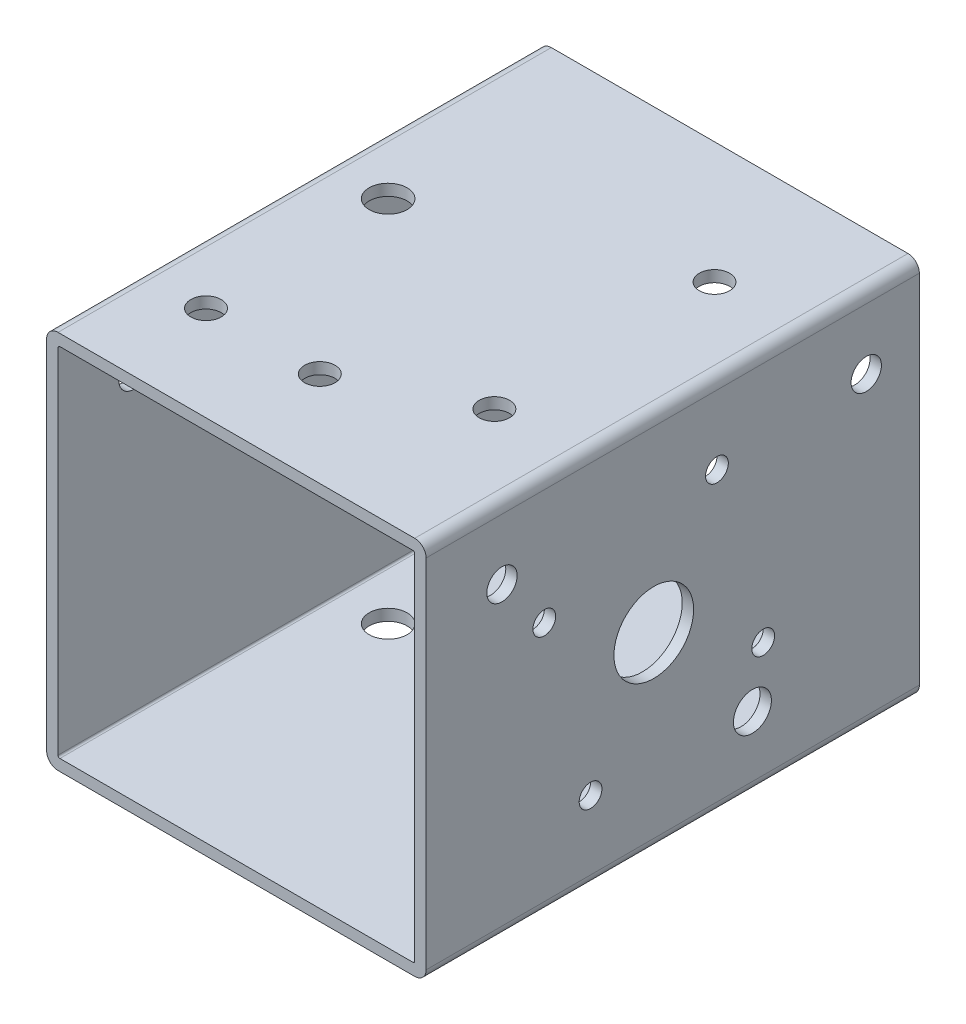
from build123d import *

# Parameters (mm, degrees)
SKETCH1_W                      = 100
SKETCH1_H                      = 100
SKETCH1_W_2                    = 94
SKETCH1_H_2                    = 94
EXTRUDE_THIN1_DEPTH            = 130
FILLET1_R                      = 0.5
FILLET2_R                      = 3
F_8_0_8_DIAMETER_HOLE2_D       = 8
F_8_0_8_DIAMETER_HOLE3_D       = 8
F_10_0_10_DIAMETER_HOLE1_D     = 10
F_10_0_10_DIAMETER_HOLE2_D     = 10
F_6_0_6_DIAMETER_HOLE2_D       = 6
F_6_0_6_DIAMETER_HOLE2_DEPTH   = 3
F_6_0_6_DIAMETER_HOLE3_D       = 6
F_6_0_6_DIAMETER_HOLE3_DEPTH   = 3
F_21_0_21_DIAMETER_HOLE1_D     = 21
F_21_0_21_DIAMETER_HOLE1_DEPTH = 3
F_6_0_6_DIAMETER_HOLE1_D       = 6
F_6_0_6_DIAMETER_HOLE1_DEPTH   = 3
F_8_0_8_DIAMETER_HOLE4_D       = 8
F_8_0_8_DIAMETER_HOLE4_DEPTH   = 3
SKETCH33_R                     = 4
CUT_EXTRUDE1_DEPTH             = 10


with BuildPart() as part:
    # Sketch1 → Extrude-Thin1 (new body)
    with BuildSketch(Plane.XY):
        Rectangle(SKETCH1_W, SKETCH1_H)
        Rectangle(SKETCH1_W_2, SKETCH1_H_2, mode=Mode.SUBTRACT)
    extrude(amount=EXTRUDE_THIN1_DEPTH)

    # Fillet1
    fillet1_edges = [part.edges().sort_by_distance(p)[0] for p in [
        (47, -47, 65),
        (47, 47, 65),
        (-47, 47, 65),
        (-47, -47, 65),
    ]]
    fillet(fillet1_edges, radius=FILLET1_R)

    # Fillet2
    fillet2_edges = [part.edges().sort_by_distance(p)[0] for p in [
        (50, -50, 65),
        (-50, -50, 65),
        (-50, 50, 65),
        (50, 50, 65),
    ]]
    fillet(fillet2_edges, radius=FILLET2_R)

    # Ø8.0 (8) Diameter Hole2 (through all)
    with Locations(Plane(origin=(0, 50, 0), x_dir=(1, 0, 0), z_dir=(0, 1, 0))):
        with Locations((28, -32), (28, -90)):
            Hole(F_8_0_8_DIAMETER_HOLE2_D / 2)

    # Ø8.0 (8) Diameter Hole3 (through all)
    with Locations(Plane(origin=(50, 0, 0), x_dir=(0, 0, -1), z_dir=(1, 0, 0))):
        with Locations((-14, 31), (-110, 31)):
            Hole(F_8_0_8_DIAMETER_HOLE3_D / 2)

    # Ø10.0 (10) Diameter Hole1 (through all)
    with Locations(Plane(origin=(0, 50, 0), x_dir=(1, 0, 0), z_dir=(0, 1, 0))):
        with Locations((-34, -56)):
            Hole(F_10_0_10_DIAMETER_HOLE1_D / 2)

    # Ø10.0 (10) Diameter Hole2 (through all)
    with Locations(Plane(origin=(50, 0, 0), x_dir=(0, 0, -1), z_dir=(1, 0, 0))):
        with Locations((-44, -31)):
            Hole(F_10_0_10_DIAMETER_HOLE2_D / 2)

    # Ø6.0 (6) Diameter Hole2
    with Locations(Plane.ZY.offset(50)):
        with Locations((56, -15), (56, 35)):
            Hole(F_6_0_6_DIAMETER_HOLE2_D / 2, depth=F_6_0_6_DIAMETER_HOLE2_DEPTH)

    # Ø6.0 (6) Diameter Hole3
    with Locations(Plane(origin=(0, -50, 0), x_dir=(-1, 0, 0), z_dir=(0, -1, 0))):
        with Locations((20, -44), (-35, -44)):
            Hole(F_6_0_6_DIAMETER_HOLE3_D / 2, depth=F_6_0_6_DIAMETER_HOLE3_DEPTH)

    # Ø21.0 (21) Diameter Hole1
    with Locations(Plane(origin=(50, 0, 0), x_dir=(0, 0, -1), z_dir=(1, 0, 0))):
        with Locations((-70, 0)):
            Hole(F_21_0_21_DIAMETER_HOLE1_D / 2, depth=F_21_0_21_DIAMETER_HOLE1_DEPTH)

    # Ø6.0 (6) Diameter Hole1
    with Locations(Plane(origin=(50, 0, 0), x_dir=(0, 0, -1), z_dir=(1, 0, 0))):
        with Locations((-41.157258279, -16.652364697), (-53.347635303, 28.842741721), (-98.842741721, 16.652364697), (-86.652364697, -28.842741721)):
            Hole(F_6_0_6_DIAMETER_HOLE1_D / 2, depth=F_6_0_6_DIAMETER_HOLE1_DEPTH)

    # Ø8.0 (8) Diameter Hole4
    with Locations(Plane(origin=(0, 50, 0), x_dir=(1, 0, 0), z_dir=(0, 1, 0))):
        with Locations((-3, -105)):
            Hole(F_8_0_8_DIAMETER_HOLE4_D / 2, depth=F_8_0_8_DIAMETER_HOLE4_DEPTH)

    # Sketch33 → Cut-Extrude1 (cut)
    with BuildSketch(Plane(origin=(0, 50, 0), x_dir=(1, 0, 0), z_dir=(0, 1, 0))):
        with Locations(Location((-33, -105, 0), (0, 0, 270))):
            Circle(SKETCH33_R)
    extrude(amount=-CUT_EXTRUDE1_DEPTH, mode=Mode.SUBTRACT)


solid = part.part
